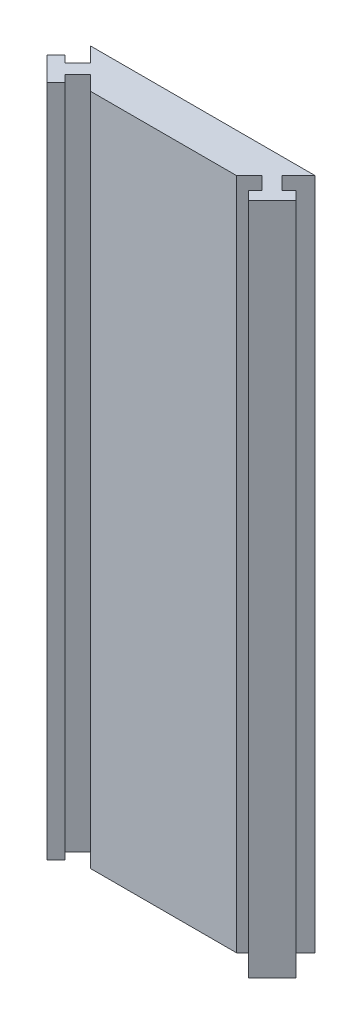
from build123d import *

# Parameters (mm, degrees)
SKETCH1_W           = 40
SKETCH1_H           = 7
BOSS_EXTRUDE3_DEPTH = 120
CUT_EXTRUDE3_DEPTH  = 120
CUT_EXTRUDE4_DEPTH  = 120
BOSS_EXTRUDE4_DEPTH = 120
BOSS_EXTRUDE5_DEPTH = 120


with BuildPart() as part:
    # Sketch1 → Boss-Extrude3 (new body)
    with BuildSketch(Plane(origin=(0, 0, 0), x_dir=(1, 0, 0), z_dir=(0, 1, 0))):
        with Locations((-32.467727981, -13.5274909)):
            Rectangle(SKETCH1_W, SKETCH1_H)
    extrude(amount=BOSS_EXTRUDE3_DEPTH)

    # Sketch6 → Cut-Extrude3 (cut)
    with BuildSketch(Plane(origin=(0, 120, 0), x_dir=(1, 0, 0), z_dir=(0, 1, 0))):
        Polygon((-52.467727981, -17.0274909), (-52.467727981, -10.0274909), (-45.467727981, -17.0274909), align=None)
    extrude(amount=-CUT_EXTRUDE3_DEPTH, mode=Mode.SUBTRACT)

    # Sketch7 → Cut-Extrude4 (cut)
    with BuildSketch(Plane(origin=(0, 120, 0), x_dir=(1, 0, 0), z_dir=(0, 1, 0))):
        Polygon((-12.467727981, -17.0274909), (-12.467727981, -10.0274909), (-19.467727981, -17.0274909), align=None)
    extrude(amount=-CUT_EXTRUDE4_DEPTH, mode=Mode.SUBTRACT)

    # Sketch8 → Boss-Extrude4 (add)
    with BuildSketch(Plane(origin=(0, 120, 0), x_dir=(1, 0, 0), z_dir=(0, 1, 0))):
        Polygon((-49.816077551, -12.679141329), (-52.11417459, -14.977238368), (-53.351611457, -13.739801501), (-54.942601715, -15.330791759), (-50.699961028, -19.573432446), (-49.10897077, -17.982442188), (-50.346407637, -16.745005321), (-48.048310598, -14.446908282), align=None)
    extrude(amount=-BOSS_EXTRUDE4_DEPTH)

    # Sketch9 → Boss-Extrude5 (add)
    with BuildSketch(Plane(origin=(0, 120, 0), x_dir=(1, 0, 0), z_dir=(0, 1, 0))):
        Polygon((-17.172372993, -14.732135912), (-14.874275954, -17.030232951), (-16.111712821, -18.267669818), (-14.520722564, -19.858660076), (-10.278081876, -15.616019388), (-11.869072134, -14.025029131), (-13.106509001, -15.262465998), (-15.40460604, -12.964368959), align=None)
    extrude(amount=-BOSS_EXTRUDE5_DEPTH)


solid = part.part
